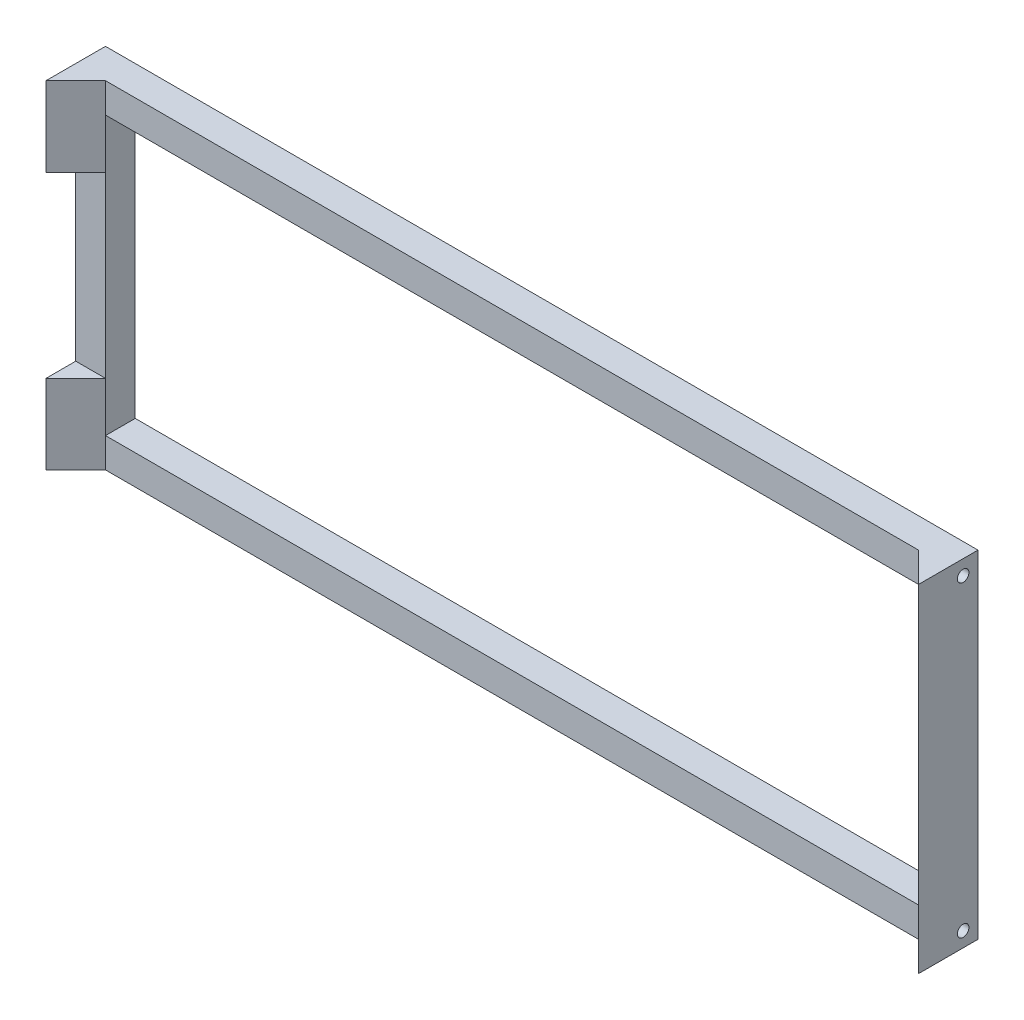
from build123d import *

# Parameters (mm, degrees)
SKETCH1_W           = 85
SKETCH1_H           = 220
SKETCH1_W_2         = 70
SKETCH1_H_2         = 205
BOSS_EXTRUDE1_DEPTH = 7.5
SKETCH2_R           = 1.45
CUT_EXTRUDE1_DEPTH  = 10
CUT_EXTRUDE2_START  = -10
SKETCH3_R           = 1.45
CUT_EXTRUDE2_DEPTH  = 10
BOSS_EXTRUDE3_DEPTH = 85
BOSS_EXTRUDE4_DEPTH = 20
BOSS_EXTRUDE5_DEPTH = 20


with BuildPart() as part:
    # Sketch1 → Boss-Extrude1 (new body)
    with BuildSketch(Plane(origin=(0, 0, 0), x_dir=(0, 1, 0), z_dir=(0, 0, 1))):
        Rectangle(SKETCH1_W, SKETCH1_H)
        Rectangle(SKETCH1_W_2, SKETCH1_H_2, mode=Mode.SUBTRACT)
    extrude(amount=BOSS_EXTRUDE1_DEPTH)

    # Sketch2 → Cut-Extrude1 (cut)
    with BuildSketch(Plane(origin=(-110, 0, 0), x_dir=(0, -1, 0), z_dir=(-1, 0, 0))):
        with Locations(Location((-38.75, 3.75, 0), (0, 0, 90))):
            Circle(SKETCH2_R)
        with Locations(Location((38.75, 3.75, 0), (0, 0, 90))):
            Circle(SKETCH2_R)
    extrude(amount=-CUT_EXTRUDE1_DEPTH, mode=Mode.SUBTRACT)

    # Sketch3 → Cut-Extrude2 (cut)
    with BuildSketch(Plane.YZ.offset(110).offset(CUT_EXTRUDE2_START)):
        with Locations(Location((-38.75, 3.75, 0), (0, 0, 90))):
            Circle(SKETCH3_R)
        with Locations(Location((38.75, 3.75, 0), (0, 0, 90))):
            Circle(SKETCH3_R)
    extrude(amount=CUT_EXTRUDE2_DEPTH, mode=Mode.SUBTRACT)

    # Sketch5 → Boss-Extrude3 (add, through all)
    with BuildSketch(Plane(origin=(0, 42.5, 0), x_dir=(-1, 0, 0), z_dir=(0, 1, 0))):
        Polygon((-110, 7.5), (-110, 15), (-102.5, 7.5), align=None)
    extrude(amount=-BOSS_EXTRUDE3_DEPTH)

    # Sketch5<4> → Boss-Extrude4 (add)
    with BuildSketch(Plane(origin=(0, 42.5, 0), x_dir=(-1, 0, 0), z_dir=(0, 1, 0))):
        Polygon((110, 7.5), (110, 15), (102.5, 7.5), align=None)
    extrude(amount=-BOSS_EXTRUDE4_DEPTH)

    # Sketch4 → Boss-Extrude5 (add)
    with BuildSketch(Plane.XZ.offset(42.5)):
        Polygon((-110, 15), (-110, 7.5), (-102.5, 7.5), align=None)
    extrude(amount=-BOSS_EXTRUDE5_DEPTH)


solid = part.part
